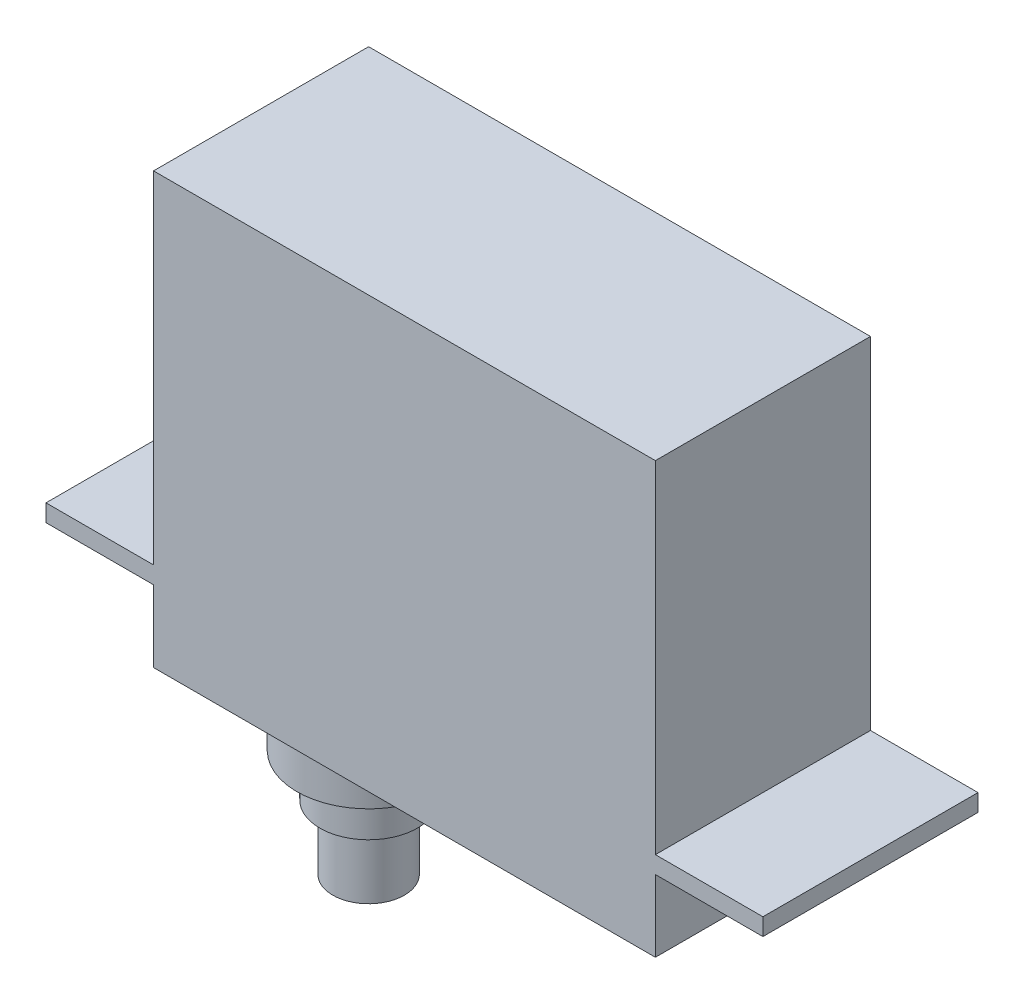
from build123d import *

# Parameters (mm, degrees)
BOSS_EXTRUDE1_DEPTH = 4.7625
SKETCH2_R           = 3.175
SKETCH2_R_2         = 1.5875
BOSS_EXTRUDE3_DEPTH = 3.175
SKETCH2_4_R         = 1.5875
BOSS_EXTRUDE4_DEPTH = 7.9375
SKETCH4_R           = 2.159
BOSS_EXTRUDE5_DEPTH = 1.905


with BuildPart() as part:
    # Sketch1 → Boss-Extrude1 (new, symmetric)
    with BuildSketch(Plane.XY):
        Polygon((0, 15.113), (0, 0), (-4.7625, 0), (-4.7625, -0.762), (0, -0.762), (0, -3.937), (1.5875, -3.937), (7.9375, -3.937), (22.225, -3.937), (22.225, -0.762), (26.9875, -0.762), (26.9875, 0), (22.225, 0), (22.225, 15.113), align=None)
    extrude(amount=BOSS_EXTRUDE1_DEPTH, both=True)

    # Sketch2 → Boss-Extrude3 (add)
    with BuildSketch(Plane.XZ.offset(3.937)):
        with Locations((4.7625, 0)):
            Circle(SKETCH2_R)
        with Locations((4.7625, 0)):
            Circle(SKETCH2_R_2, mode=Mode.SUBTRACT)
    extrude(amount=BOSS_EXTRUDE3_DEPTH)

    # Sketch2<4> → Boss-Extrude4 (add)
    with BuildSketch(Plane.XZ.offset(3.937)):
        with Locations((4.7625, 0)):
            Circle(SKETCH2_4_R)
    extrude(amount=BOSS_EXTRUDE4_DEPTH)

    # Sketch4 → Boss-Extrude5 (add)
    with BuildSketch(Plane.XZ.offset(7.112)):
        with Locations((4.7625, 0)):
            Circle(SKETCH4_R)
    extrude(amount=BOSS_EXTRUDE5_DEPTH)


solid = part.part
